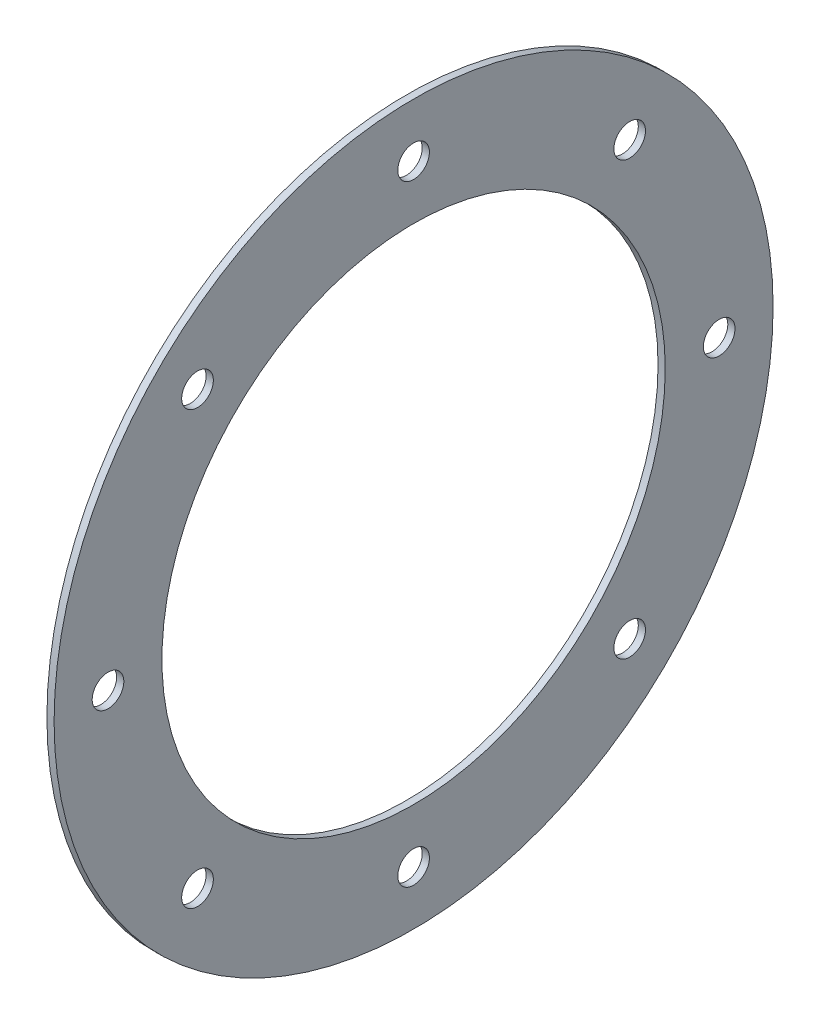
from build123d import *

# Parameters (mm, degrees)
SKETCH_1_R      = 100
SKETCH_1_R_2    = 70
SKETCH_1_R_3    = 4.4
EXTRUDE_1_DEPTH = 2


with BuildPart() as part:
    # Эскиз1 → Бобышка-Вытянуть1 (new body)
    with BuildSketch(Plane(origin=(0, 0, 0), x_dir=(0, 0, -1), z_dir=(1, 0, 0))):
        Circle(SKETCH_1_R)
        Circle(SKETCH_1_R_2, mode=Mode.SUBTRACT)
        with Locations((0, 85)):
            Circle(SKETCH_1_R_3, mode=Mode.SUBTRACT)
        with Locations((60.104076401, 60.104076401)):
            Circle(SKETCH_1_R_3, mode=Mode.SUBTRACT)
        with Locations((85, 0)):
            Circle(SKETCH_1_R_3, mode=Mode.SUBTRACT)
        with Locations((60.104076401, -60.104076401)):
            Circle(SKETCH_1_R_3, mode=Mode.SUBTRACT)
        with Locations((0, -85)):
            Circle(SKETCH_1_R_3, mode=Mode.SUBTRACT)
        with Locations((-60.104076401, -60.104076401)):
            Circle(SKETCH_1_R_3, mode=Mode.SUBTRACT)
        with Locations((-85, 0)):
            Circle(SKETCH_1_R_3, mode=Mode.SUBTRACT)
        with Locations((-60.104076401, 60.104076401)):
            Circle(SKETCH_1_R_3, mode=Mode.SUBTRACT)
    extrude(amount=EXTRUDE_1_DEPTH)


solid = part.part
